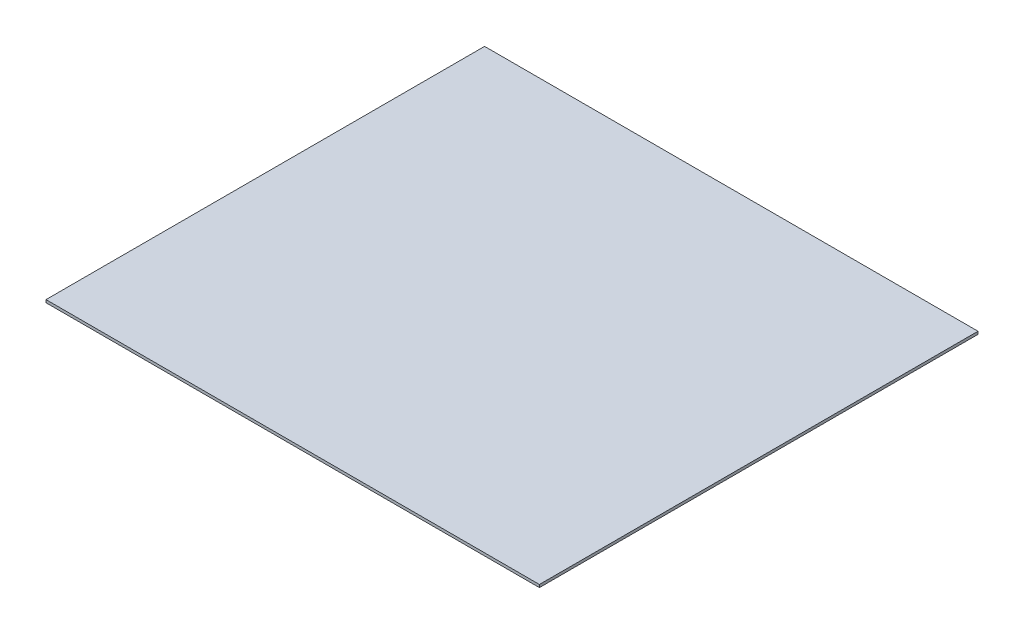
from build123d import *

# Parameters (mm, degrees)
SKETCH1_W           = 180
SKETCH1_H           = 160
BOSS_EXTRUDE1_DEPTH = 1


with BuildPart() as part:
    # Sketch1 → Boss-Extrude1 (new body)
    with BuildSketch(Plane(origin=(0, 0, 0), x_dir=(1, 0, 0), z_dir=(0, 1, 0))):
        Rectangle(SKETCH1_W, SKETCH1_H)
    extrude(amount=BOSS_EXTRUDE1_DEPTH)


solid = part.part
